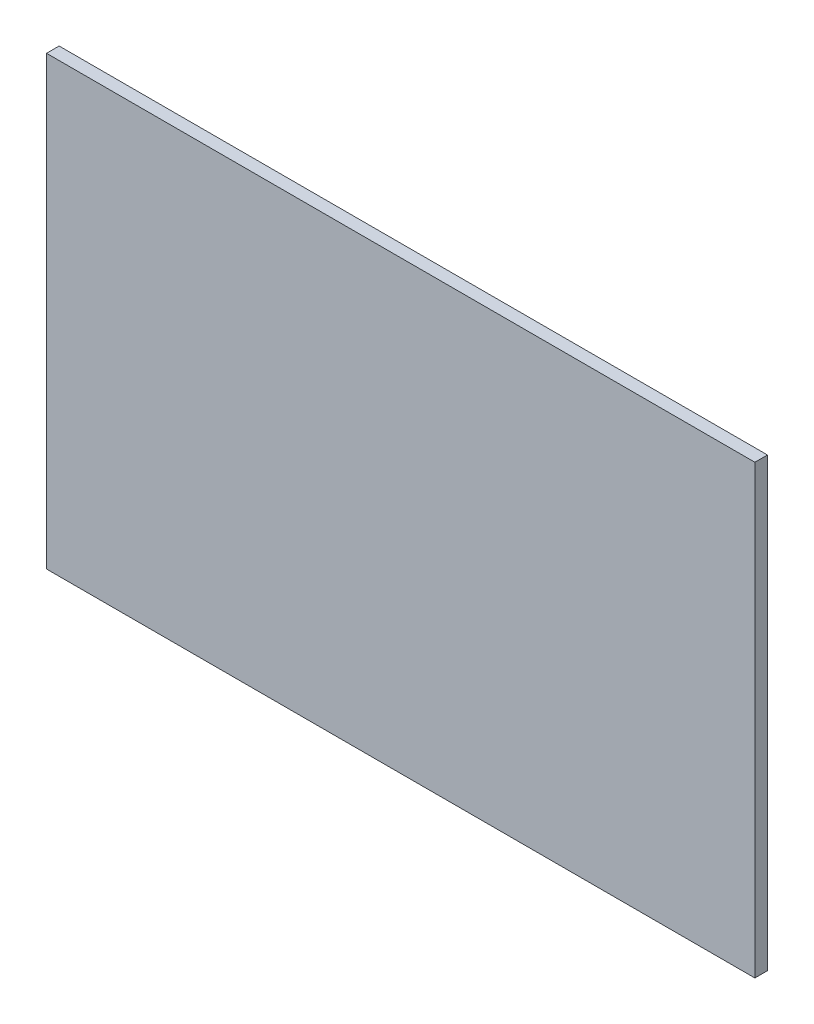
from build123d import *

# Parameters (mm, degrees)
SKETCH1_W           = 134.8
SKETCH1_H           = 85
BOSS_EXTRUDE1_DEPTH = 2.4


with BuildPart() as part:
    # Sketch1 → Boss-Extrude1 (new body)
    with BuildSketch(Plane.XY):
        Rectangle(SKETCH1_W, SKETCH1_H)
    extrude(amount=BOSS_EXTRUDE1_DEPTH)


solid = part.part
